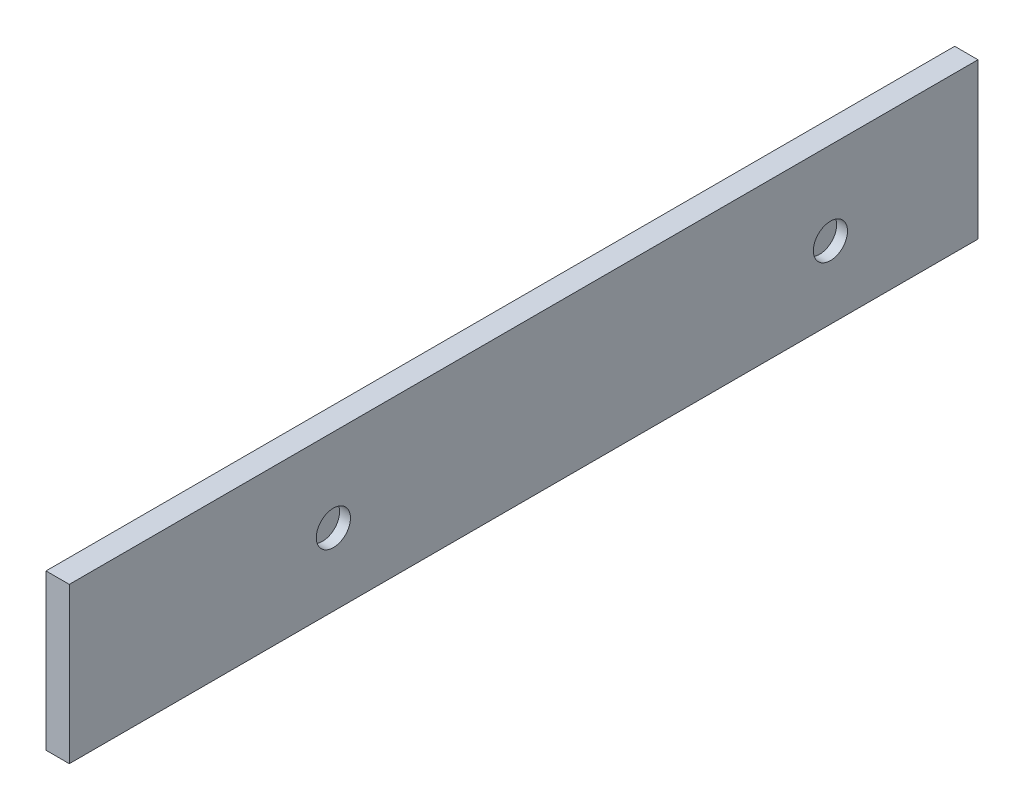
from build123d import *

# Parameters (mm, degrees)
CROQUIS1_W              = 585
CROQUIS1_H              = 100
SALIENTE_EXTRUIR1_DEPTH = 15
CROQUIS2_R              = 11
CORTAR_EXTRUIR1_DEPTH   = 7


with BuildPart() as part:
    # Croquis1 → Saliente-Extruir1 (new body)
    with BuildSketch(Plane(origin=(0, 0, 0), x_dir=(0, 0, -1), z_dir=(1, 0, 0))):
        with Locations((292.5, 50)):
            Rectangle(CROQUIS1_W, CROQUIS1_H)
    extrude(amount=SALIENTE_EXTRUIR1_DEPTH)

    # Croquis2 → Cortar-Extruir1 (cut)
    with BuildSketch(Plane(origin=(15, 0, 0), x_dir=(0, 0, -1), z_dir=(1, 0, 0))):
        with Locations((170, 46.5)):
            Circle(CROQUIS2_R)
        with Locations((490, 46.5)):
            Circle(CROQUIS2_R)
    extrude(amount=-CORTAR_EXTRUIR1_DEPTH, mode=Mode.SUBTRACT)


solid = part.part
